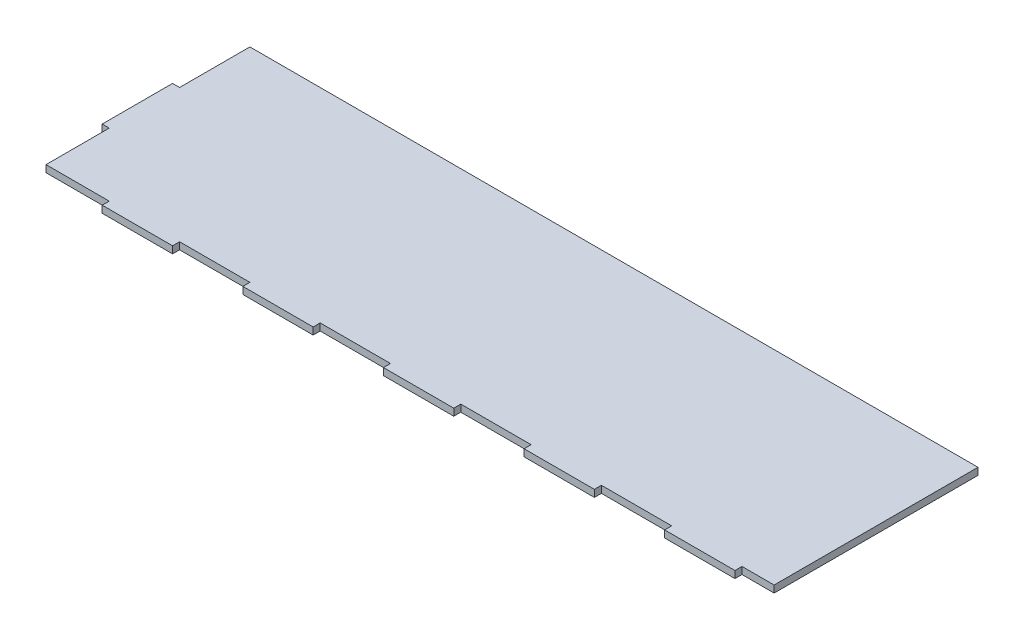
from build123d import *

# Parameters (mm, degrees)
SKETCH1_W           = 630
SKETCH1_H           = 90
BOSS_EXTRUDE1_DEPTH = 3
SKETCH3_W           = 30
SKETCH3_H           = 3
CUT_EXTRUDE1_DEPTH  = 3
LPATTERN1_COUNT     = 10
LPATTERN1_PITCH     = 60
LPATTERN1_COL_COUNT = 2
LPATTERN1_COL_PITCH = 60
SKETCH7_W           = 3
SKETCH7_H           = 30
CUT_EXTRUDE3_DEPTH  = 3
SKETCH13_W          = 3
SKETCH13_H          = 27
CUT_EXTRUDE4_DEPTH  = 10


with BuildPart() as part:
    # Sketch1 → Boss-Extrude1 (new body)
    with BuildSketch(Plane(origin=(0, 0, 0), x_dir=(1, 0, 0), z_dir=(0, 1, 0))):
        Rectangle(SKETCH1_W, SKETCH1_H)
    extrude(amount=BOSS_EXTRUDE1_DEPTH)

    # Sketch3 → Cut-Extrude1 (cut)
    with BuildSketch(Plane(origin=(0, 3, 0), x_dir=(1, 0, 0), z_dir=(0, 1, 0))):
        with Locations((-240, -43.5)):
            Rectangle(SKETCH3_W, SKETCH3_H)
    cut_extrude1 = extrude(amount=-CUT_EXTRUDE1_DEPTH, mode=Mode.SUBTRACT)

    # LPattern1: Cut-Extrude1 ×10
    with Locations(*[(i * LPATTERN1_PITCH, 0, 0) for i in range(1, LPATTERN1_COUNT)]):
        add(cut_extrude1, mode=Mode.SUBTRACT)

    # LPattern1 col: Cut-Extrude1 ×2
    with Locations(*[(-i * LPATTERN1_COL_PITCH, 0, 0) for i in range(1, LPATTERN1_COL_COUNT)]):
        add(cut_extrude1, mode=Mode.SUBTRACT)

    # Sketch7 → Cut-Extrude3 (cut)
    with BuildSketch(Plane(origin=(0, 3, 0), x_dir=(1, 0, 0), z_dir=(0, 1, 0))):
        with Locations((-313.5, 30)):
            Rectangle(SKETCH7_W, SKETCH7_H)
    extrude(amount=-CUT_EXTRUDE3_DEPTH, mode=Mode.SUBTRACT)

    # Sketch13 → Cut-Extrude4 (cut)
    with BuildSketch(Plane(origin=(0, 3, 0), x_dir=(1, 0, 0), z_dir=(0, 1, 0))):
        with Locations((-313.5, -28.5)):
            Rectangle(SKETCH13_W, SKETCH13_H)
    extrude(amount=-CUT_EXTRUDE4_DEPTH, mode=Mode.SUBTRACT)

    # SurfaceCut1
    split(bisect_by=Plane(origin=(-1.295, 0, 0), x_dir=(0, 0, -1), z_dir=(1, 0, 0)), keep=Keep.BOTTOM)


solid = part.part
